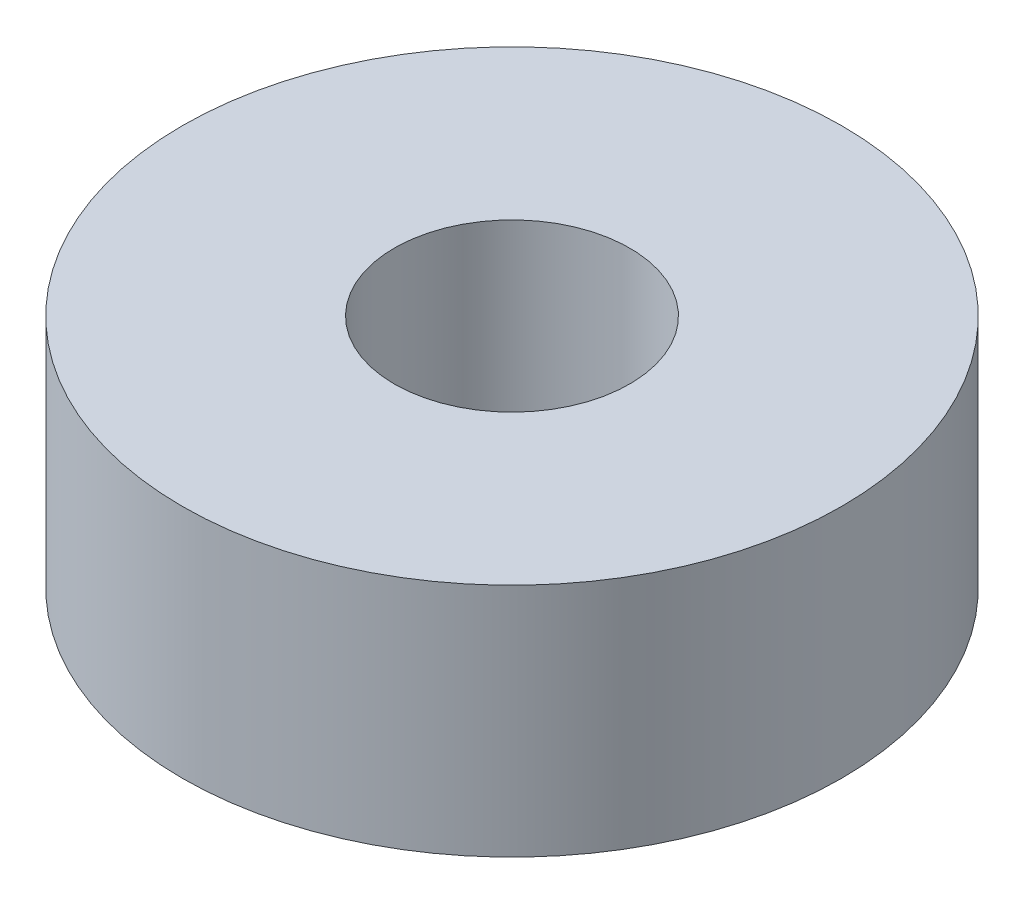
from build123d import *

# Parameters (mm, degrees)
SKETCH_1_R      = 7
SKETCH_1_R_2    = 2.5
EXTRUDE_1_DEPTH = 5


with BuildPart() as part:
    # 草图1 → 凸台-拉伸1 (new body)
    with BuildSketch(Plane(origin=(0, 0, 0), x_dir=(1, 0, 0), z_dir=(0, 1, 0))):
        with Locations(Location((0, 0, 0), (0, 0, 270))):
            Circle(SKETCH_1_R)
        with Locations(Location((0, 0, 0), (0, 0, 270))):
            Circle(SKETCH_1_R_2, mode=Mode.SUBTRACT)
    extrude(amount=EXTRUDE_1_DEPTH)


solid = part.part
